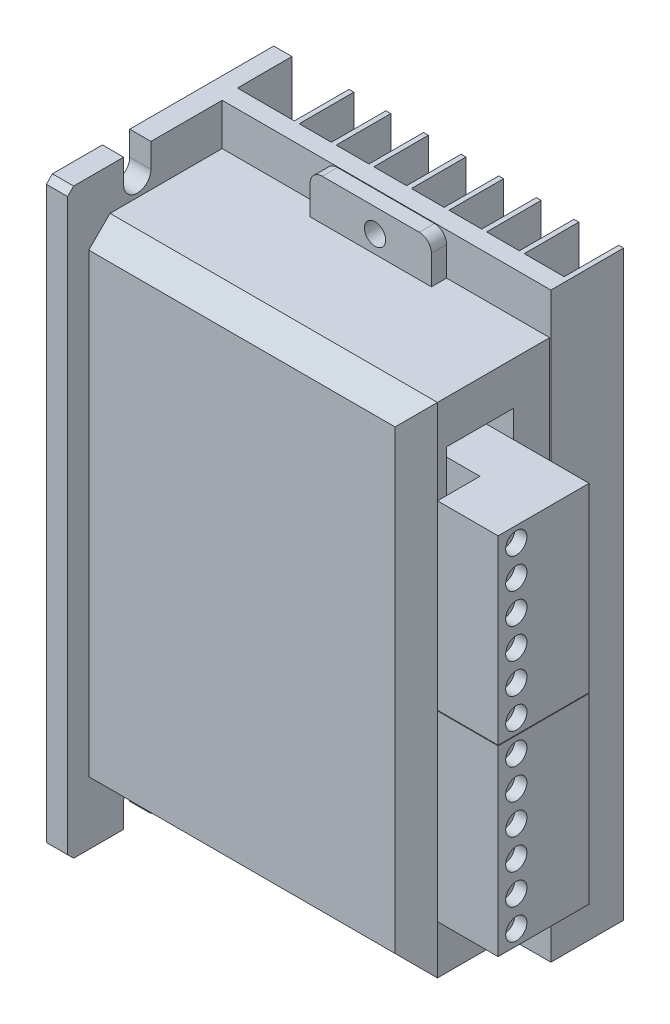
from build123d import *

# Parameters (mm, degrees)
SKETCH_1_W             = 54
SKETCH_1_H             = 82.2
EXTRUDE_1_DEPTH        = 22
CHAMFER_1_SIZE         = 3.5
SKETCH_2_W             = 54.2
SKETCH_2_H             = 96
EXTRUDE_2_DEPTH        = 12
EXTRUDE_3_DEPTH        = 3.5
CHAMFER_2_SIZE         = 1
SKETCH_5_W             = 9.4
SKETCH_5_H             = 96
SKETCH_5_W_2           = 5.3
SKETCH_5_W_3           = 5.4
SKETCH_5_W_4           = 6.593289258
CUT_EXTRUDE_2_DEPTH    = 9
SKETCH_6_W             = 11
SKETCH_6_H             = 68
CUT_EXTRUDE_3_DEPTH    = 7
SKETCH_7_W             = 8
SKETCH_7_H             = 30
EXTRUDE_5_DEPTH        = 10
SKETCH_8_W             = 15
SKETCH_8_H             = 30.09688029
SKETCH_8_H_2           = 29.900272582
EXTRUDE_6_DEPTH        = 10
SKETCH_9_R             = 1.75
CUT_EXTRUDE_4_DEPTH    = 2
SKETCH_10_W            = 20
SKETCH_10_H            = 2.5
EXTRUDE_7_DEPTH        = 6.8
CUT_EXTRUDE_START      = -5
SKETCH_4_R             = 1.75
CUT_EXTRUDE_1_DEPTH    = 75.485183559
FILLET_1_R             = 2
FILLET_1_OF_MIRROR_1_R = 2


with BuildPart() as part:
    # Эскиз1 → Бобышка-Вытянуть1 (new body)
    with BuildSketch(Plane.XY):
        Rectangle(SKETCH_1_W, SKETCH_1_H)
    extrude(amount=EXTRUDE_1_DEPTH)

    # Фаска1
    chamfer_1_edges = [part.edges().sort_by_distance(p)[0] for p in [
        (0, -41.1, 22),
        (27, 0, 22),
        (0, 41.1, 22),
    ]]
    chamfer(chamfer_1_edges, length=CHAMFER_1_SIZE)

    # Эскиз2 → Бобышка-Вытянуть2 (add)
    with BuildSketch(Plane(origin=(0, 0, 0), x_dir=(-1, 0, 0), z_dir=(0, 0, -1))):
        with Locations((-0.1, 0)):
            Rectangle(SKETCH_2_W, SKETCH_2_H)
    extrude(amount=EXTRUDE_2_DEPTH)

    # Эскиз3 → Бобышка-Вытянуть3 (add)
    with BuildSketch(Plane.ZY.offset(27)):
        with BuildLine():
            Line((-12, 48), (11.75, 48))
            Line((11.75, 48), (11.75, 44))
            ThreePointArc((11.75, 44), (14, 41.75), (16.25, 44))
            Line((16.25, 44), (16.25, 48))
            Line((16.25, 48), (25.5, 48))
            Line((25.5, 48), (25.5, -48))
            Line((25.5, -48), (16.25, -48))
            Line((16.25, -48), (16.25, -44))
            ThreePointArc((16.25, -44), (14, -41.75), (11.75, -44))
            Line((11.75, -44), (11.75, -48))
            Line((11.75, -48), (-12, -48))
            Line((-12, -48), (-12, 48))
        make_face()
    extrude(amount=EXTRUDE_3_DEPTH)

    # Фаска2
    chamfer_2_edges = [part.edges().sort_by_distance(p)[0] for p in [
        (-28.75, -48, 25.5),
        (-28.75, 48, 25.5),
    ]]
    chamfer(chamfer_2_edges, length=CHAMFER_2_SIZE)

    # Эскиз5 → Вырез-Вытянуть2 (cut)
    with BuildSketch(Plane(origin=(0, 0, -12), x_dir=(-1, 0, 0), z_dir=(0, 0, -1))):
        with Locations((22.8, 0)):
            Rectangle(SKETCH_5_W, SKETCH_5_H)
        with Locations((14.65, 0)):
            Rectangle(SKETCH_5_W_2, SKETCH_5_H)
        with Locations((8.5, 0)):
            Rectangle(SKETCH_5_W_3, SKETCH_5_H)
        with Locations((2.3, 0)):
            Rectangle(SKETCH_5_W_3, SKETCH_5_H)
        with Locations((-3.9, 0)):
            Rectangle(SKETCH_5_W_3, SKETCH_5_H)
        with Locations((-10.1, 0)):
            Rectangle(SKETCH_5_W_3, SKETCH_5_H)
        with Locations((-16.3, 0)):
            Rectangle(SKETCH_5_W_3, SKETCH_5_H)
        with Locations((-23.096644629, 0)):
            Rectangle(SKETCH_5_W_4, SKETCH_5_H)
    extrude(amount=-CUT_EXTRUDE_2_DEPTH, mode=Mode.SUBTRACT)

    # Эскиз6 → Вырез-Вытянуть3 (cut)
    with BuildSketch(Plane(origin=(27, 0, 0), x_dir=(0, 0, -1), z_dir=(1, 0, 0))):
        with Locations((-11.5, 0)):
            Rectangle(SKETCH_6_W, SKETCH_6_H)
    extrude(amount=-CUT_EXTRUDE_3_DEPTH, mode=Mode.SUBTRACT)

    # Эскиз7 → Бобышка-Вытянуть5 (add)
    with BuildSketch(Plane(origin=(20, 0, 0), x_dir=(0, 0, -1), z_dir=(1, 0, 0))):
        with Locations((-10.5, -15.05)):
            Rectangle(SKETCH_7_W, SKETCH_7_H)
        with Locations((-10.5, 15.05)):
            Rectangle(SKETCH_7_W, SKETCH_7_H)
    extrude(amount=EXTRUDE_5_DEPTH)

    # Эскиз8 → Бобышка-Вытянуть6 (add)
    with BuildSketch(Plane(origin=(30, 0, 0), x_dir=(0, 0, -1), z_dir=(1, 0, 0))):
        with Locations((-14, -15.001559855)):
            Rectangle(SKETCH_8_W, SKETCH_8_H)
        with Locations((-14, 15.099863709)):
            Rectangle(SKETCH_8_W, SKETCH_8_H_2)
    extrude(amount=EXTRUDE_6_DEPTH)

    # Эскиз9 → Вырез-Вытянуть4 (cut)
    with BuildSketch(Plane(origin=(40, 0, 0), x_dir=(0, 0, -1), z_dir=(1, 0, 0))):
        with Locations((-18.5, -27.55)):
            Circle(SKETCH_9_R)
        with Locations((-18.5, -22.55)):
            Circle(SKETCH_9_R)
        with Locations((-18.5, -17.55)):
            Circle(SKETCH_9_R)
        with Locations((-18.5, -12.55)):
            Circle(SKETCH_9_R)
        with Locations((-18.5, -7.55)):
            Circle(SKETCH_9_R)
        with Locations((-18.5, -2.55)):
            Circle(SKETCH_9_R)
        with Locations((-18.5, 2.55)):
            Circle(SKETCH_9_R)
        with Locations((-18.5, 7.55)):
            Circle(SKETCH_9_R)
        with Locations((-18.5, 12.55)):
            Circle(SKETCH_9_R)
        with Locations((-18.5, 17.55)):
            Circle(SKETCH_9_R)
        with Locations((-18.5, 22.55)):
            Circle(SKETCH_9_R)
        with Locations((-18.5, 27.55)):
            Circle(SKETCH_9_R)
    extrude(amount=-CUT_EXTRUDE_4_DEPTH, mode=Mode.SUBTRACT)

    # Эскиз10 → Бобышка-Вытянуть7 (add)
    with BuildSketch(Plane(origin=(0, 41.1, 0), x_dir=(1, 0, 0), z_dir=(0, 1, 0))):
        with Locations((0, -1.25)):
            Rectangle(SKETCH_10_W, SKETCH_10_H)
    extrude_7 = extrude(amount=EXTRUDE_7_DEPTH)

    # Эскиз4 → Вырез-Вытянуть1 (cut)
    with BuildSketch(Plane.XY.offset(CUT_EXTRUDE_START)):
        with Locations(Location((0.7, -44, 0), (0, 0, 99.870889606))):
            Circle(SKETCH_4_R)
        with Locations(Location((0.7, 44, 0), (0, 0, 180))):
            Circle(SKETCH_4_R)
    cut_extrude_1 = extrude(amount=CUT_EXTRUDE_1_DEPTH, mode=Mode.SUBTRACT)

    # Скругление1
    fillet_1_edges = [part.edges().sort_by_distance(p)[0] for p in [
        (10, 47.9, 1.25),
        (-10, 47.9, 1.25),
    ]]
    fillet(fillet_1_edges, radius=FILLET_1_R)

    # Зеркальное отражение1: Бобышка-Вытянуть7, Вырез-Вытянуть1 across plane
    add(extrude_7.mirror(Plane.ZX))
    add(cut_extrude_1.mirror(Plane.ZX), mode=Mode.SUBTRACT)

    # Скругление1 of Зеркальное отражение1
    fillet_1_of_mirror_1_edges = [part.edges().sort_by_distance(p)[0] for p in [
        (10, -47.9, 1.25),
        (-10, -47.9, 1.25),
    ]]
    fillet(fillet_1_of_mirror_1_edges, radius=FILLET_1_OF_MIRROR_1_R)


solid = part.part
